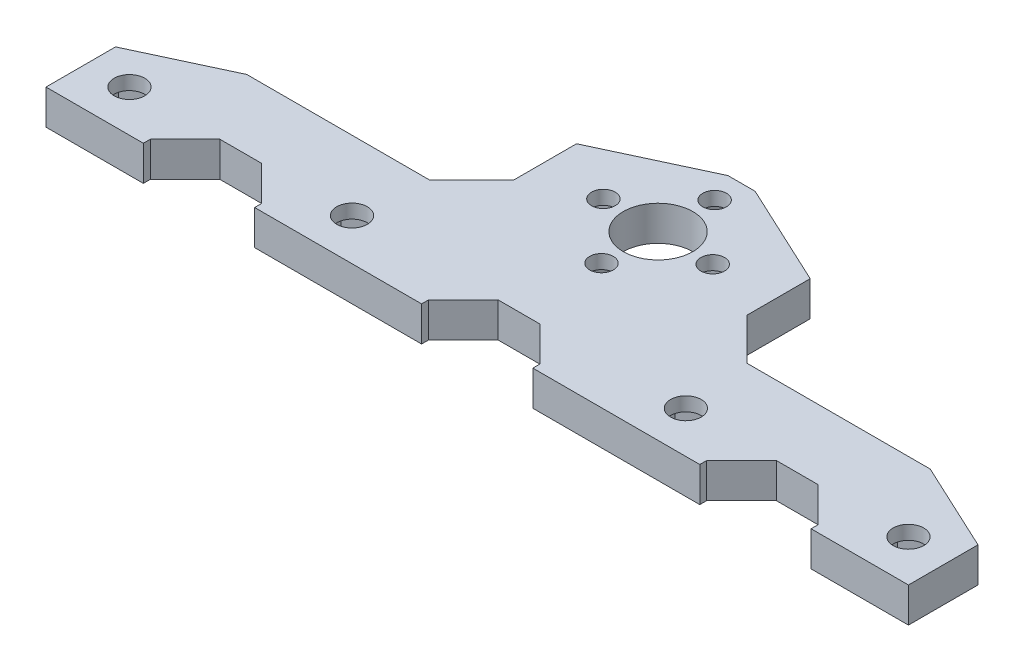
from build123d import *
from OCP.BRepFilletAPI import BRepFilletAPI_MakeChamfer

# Parameters (mm, degrees)
SKETCH1_W           = 124
SKETCH1_H           = 42
BOSS_EXTRUDE1_DEPTH = 5
SKETCH2_R           = 5
CUT_EXTRUDE1_DEPTH  = 5
SKETCH3_W           = 124
SKETCH3_H           = 42
SKETCH3_R           = 2.2
SKETCH3_R_2         = 1.7
SKETCH3_R_3         = 5
BOSS_EXTRUDE2_DEPTH = 2
CHAMFER1_SIZE       = 28
CHAMFER1_SIZE2      = 60.046193774
CUT_EXTRUDE2_DEPTH  = 10
LPATTERN1_COUNT     = 3
LPATTERN1_PITCH     = 40
SKETCH5_W           = 124
SKETCH5_H           = 4
CUT_EXTRUDE3_DEPTH  = 10
CUT_EXTRUDE4_DEPTH  = 10
CHAMFER2_SIZE       = 6


with BuildPart() as part:
    # Sketch1 → Boss-Extrude1 (new body)
    with BuildSketch(Plane.XZ.offset(-139.173467121)):
        with Locations((90.436218841, 110.61857787)):
            Rectangle(SKETCH1_W, SKETCH1_H)
        Polygon((87.341918286, 93.619783108), (88.95849904, 90.819783108), (92.191660547, 90.819783108), (93.808241301, 93.619783108), (92.191660547, 96.419783108), (88.95849904, 96.419783108), align=None, mode=Mode.SUBTRACT)
        Polygon((98.435013602, 98.524277315), (101.235013602, 100.140858069), (101.235013602, 103.374019576), (98.435013602, 104.99060033), (95.635013602, 103.374019576), (95.635013602, 100.140858069), align=None, mode=Mode.SUBTRACT)
        Polygon((82.437424079, 104.712878424), (79.637424079, 103.09629767), (79.637424079, 99.863136163), (82.437424079, 98.246555409), (85.237424079, 99.863136163), (85.237424079, 103.09629767), align=None, mode=Mode.SUBTRACT)
        Polygon((93.530519395, 109.617372631), (91.913938641, 112.417372631), (88.680777134, 112.417372631), (87.06419638, 109.617372631), (88.680777134, 106.817372631), (91.913938641, 106.817372631), align=None, mode=Mode.SUBTRACT)
        Polygon((34.436218841, 125.890969862), (30.736218841, 123.754773866), (30.736218841, 119.482381874), (34.436218841, 117.346185878), (38.136218841, 119.482381874), (38.136218841, 123.754773866), align=None, mode=Mode.SUBTRACT)
        Polygon((62.736218841, 123.754773866), (62.736218841, 119.482381874), (66.436218841, 117.346185878), (70.136218841, 119.482381874), (70.136218841, 123.754773866), (66.436218841, 125.890969862), align=None, mode=Mode.SUBTRACT)
        Polygon((118.136218841, 123.754773866), (114.436218841, 125.890969862), (110.736218841, 123.754773866), (110.736218841, 119.482381874), (114.436218841, 117.346185878), (118.136218841, 119.482381874), align=None, mode=Mode.SUBTRACT)
        Polygon((142.736218841, 119.482381874), (146.436218841, 117.346185878), (150.136218841, 119.482381874), (150.136218841, 123.754773866), (146.436218841, 125.890969862), (142.736218841, 123.754773866), align=None, mode=Mode.SUBTRACT)
    extrude(amount=BOSS_EXTRUDE1_DEPTH)

    # Sketch2 → Cut-Extrude1 (cut)
    with BuildSketch(Plane(origin=(0, 139.173467121, 0), x_dir=(1, 0, 0), z_dir=(0, 1, 0))):
        with Locations(Location((90.436218841, -101.61857787, 0), (0, 0, 270))):
            Circle(SKETCH2_R)
    extrude(amount=-CUT_EXTRUDE1_DEPTH, mode=Mode.SUBTRACT)

    # Sketch3 → Boss-Extrude2 (add)
    with BuildSketch(Plane(origin=(0, 139.173467121, 0), x_dir=(1, 0, 0), z_dir=(0, 1, 0))):
        with Locations((90.436218841, -110.61857787)):
            Rectangle(SKETCH3_W, SKETCH3_H)
        with Locations(Location((34.436218841, -121.61857787, 0), (0, 0, 270))):
            Circle(SKETCH3_R, mode=Mode.SUBTRACT)
        with Locations(Location((66.436218841, -121.61857787, 0), (0, 0, 270))):
            Circle(SKETCH3_R, mode=Mode.SUBTRACT)
        with Locations(Location((114.436218841, -121.61857787, 0), (0, 0, 270))):
            Circle(SKETCH3_R, mode=Mode.SUBTRACT)
        with Locations(Location((146.436218841, -121.61857787, 0), (0, 0, 270))):
            Circle(SKETCH3_R, mode=Mode.SUBTRACT)
        with Locations(Location((90.575079793, -93.619783108, 0), (0, 0, 270))):
            Circle(SKETCH3_R_2, mode=Mode.SUBTRACT)
        with Locations(Location((82.437424079, -101.479716917, 0), (0, 0, 270))):
            Circle(SKETCH3_R_2, mode=Mode.SUBTRACT)
        with Locations(Location((90.297357888, -109.617372631, 0), (0, 0, 270))):
            Circle(SKETCH3_R_2, mode=Mode.SUBTRACT)
        with Locations(Location((98.435013602, -101.757438823, 0), (0, 0, 270))):
            Circle(SKETCH3_R_2, mode=Mode.SUBTRACT)
        with Locations(Location((90.436218841, -101.61857787, 0), (0, 0, 270))):
            Circle(SKETCH3_R_3, mode=Mode.SUBTRACT)
    extrude(amount=-BOSS_EXTRUDE2_DEPTH)

    # Chamfer1: one chamfer whose edges measure the first distance from different faces: ONE call of the kernel's chamfer builder (chamfer() names one face for all edges)
    chamfer1_edges_1 = [part.edges().sort_by_distance(p)[0] for p in [
        (152.436218841, 136.673467121, 89.61857787),
    ]]
    chamfer1_side_1 = [part.faces().sort_by_distance(p)[0] for p in [
        (152.436218841, 136.673467121, 110.61857787),
    ]]
    chamfer1_edges_2 = [part.edges().sort_by_distance(p)[0] for p in [
        (28.436218841, 136.673467121, 89.61857787),
    ]]
    chamfer1_side_2 = [part.faces().sort_by_distance(p)[0] for p in [
        (28.436218841, 136.673467121, 110.61857787),
    ]]
    chamfer1 = BRepFilletAPI_MakeChamfer(part.part.solid().wrapped)
    for e in chamfer1_edges_1:
        chamfer1.Add(CHAMFER1_SIZE, CHAMFER1_SIZE2, e.wrapped, chamfer1_side_1[0].wrapped)  # the first distance lies on this face
    for e in chamfer1_edges_2:
        chamfer1.Add(CHAMFER1_SIZE, CHAMFER1_SIZE2, e.wrapped, chamfer1_side_2[0].wrapped)  # the first distance lies on this face
    add(Compound.cast(chamfer1.Shape()), mode=Mode.REPLACE)

    # Sketch4 → Cut-Extrude2 (cut)
    with BuildSketch(Plane.XZ.offset(-134.173467121)):
        Polygon((42.436218841, 131.61857787), (58.436218841, 131.61857787), (58.436218841, 126.61857787), (53.436218841, 121.61857787), (47.436218841, 121.61857787), (42.436218841, 126.61857787), align=None)
    cut_extrude2 = extrude(amount=-CUT_EXTRUDE2_DEPTH, mode=Mode.SUBTRACT)

    # LPattern1: Cut-Extrude2 ×3
    with Locations(*[(i * LPATTERN1_PITCH, 0, 0) for i in range(1, LPATTERN1_COUNT)]):
        add(cut_extrude2, mode=Mode.SUBTRACT)

    # Sketch5 → Cut-Extrude3 (cut)
    with BuildSketch(Plane.XZ.offset(-134.173467121)):
        with Locations((90.436218841, 129.61857787)):
            Rectangle(SKETCH5_W, SKETCH5_H)
    extrude(amount=-CUT_EXTRUDE3_DEPTH, mode=Mode.SUBTRACT)

    # Sketch6 → Cut-Extrude4 (cut)
    with BuildSketch(Plane.XZ.offset(-134.173467121)):
        Polygon((41.303260364, 111.61857787), (73.637424079, 111.61857787), (73.637424079, 96.540909709), align=None)
        Polygon((107.235013602, 111.61857787), (107.235013602, 96.540909709), (139.569177317, 111.61857787), align=None)
    extrude(amount=-CUT_EXTRUDE4_DEPTH, mode=Mode.SUBTRACT)

    # Chamfer2
    chamfer2_edges = [part.edges().sort_by_distance(p)[0] for p in [
        (73.637424079, 136.673467121, 111.61857787),
        (107.235013602, 136.673467121, 111.61857787),
    ]]
    chamfer(chamfer2_edges, length=CHAMFER2_SIZE)


solid = part.part
